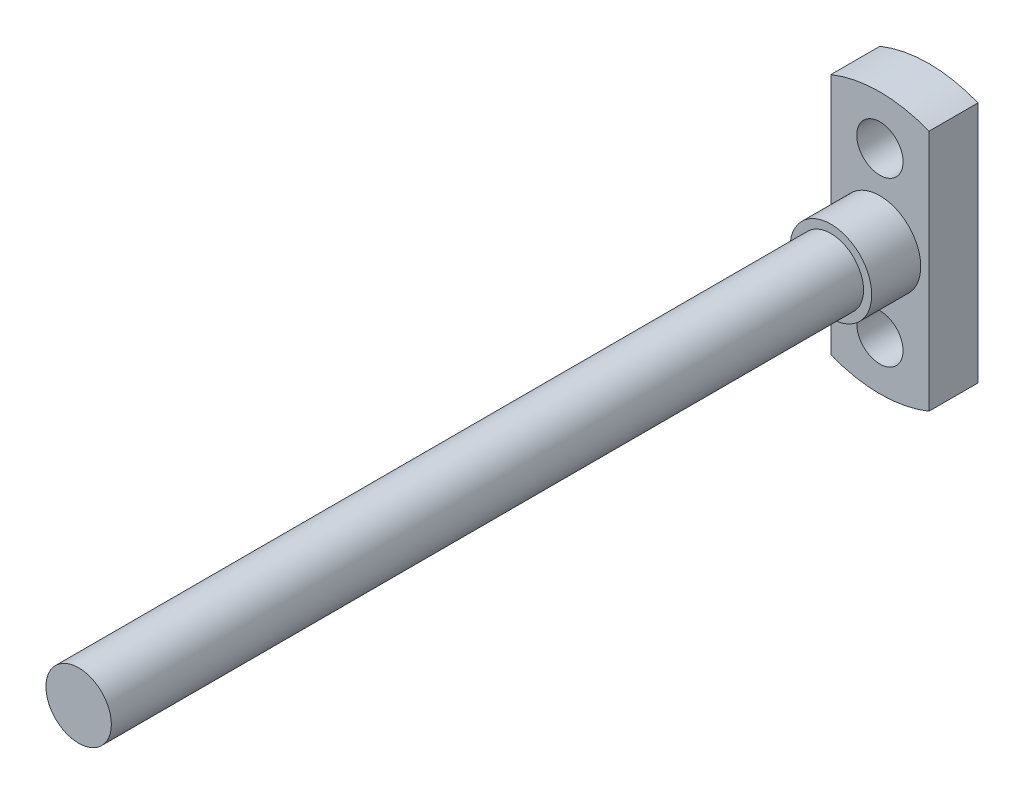
from build123d import *

# Parameters (mm, degrees)
BOSS_EXTRUDE1_DEPTH         = 4.7625
SKETCH2_R                   = 3.96875
BOSS_EXTRUDE2_DEPTH         = 4.7625
SKETCH3_R                   = 3.175
BOSS_EXTRUDE3_DEPTH         = 73.025
F_16_0_177_DIAMETER_HOLE1_D = 4.4958


with BuildPart() as part:
    # Sketch1 → Boss-Extrude1 (new body)
    with BuildSketch(Plane.XY):
        with BuildLine():
            Line((0, 0), (0, 23.546430197))
            ThreePointArc((0, 23.546430197), (4.7625, 24.473215098), (9.525, 23.546430197))
            Line((9.525, 23.546430197), (9.525, 0))
            ThreePointArc((9.525, 0), (4.7625, -0.926784902), (0, 0))
        make_face()
    extrude(amount=BOSS_EXTRUDE1_DEPTH)

    # Sketch2 → Boss-Extrude2 (add)
    with BuildSketch(Plane.XY.offset(4.7625)):
        with Locations(Location((4.7625, 11.773215098, 0), (0, 0, 180))):
            Circle(SKETCH2_R)
    extrude(amount=BOSS_EXTRUDE2_DEPTH)

    # Sketch3 → Boss-Extrude3 (add)
    with BuildSketch(Plane.XY.offset(9.525)):
        with Locations((4.7625, 11.773215098)):
            Circle(SKETCH3_R)
    extrude(amount=BOSS_EXTRUDE3_DEPTH)

    # #16 (0.177) Diameter Hole1 (through all)
    with Locations(Plane.XY.offset(4.7625)):
        with Locations((4.7625, 3.835715098), (4.7625, 19.710715098)):
            Hole(F_16_0_177_DIAMETER_HOLE1_D / 2)


solid = part.part
